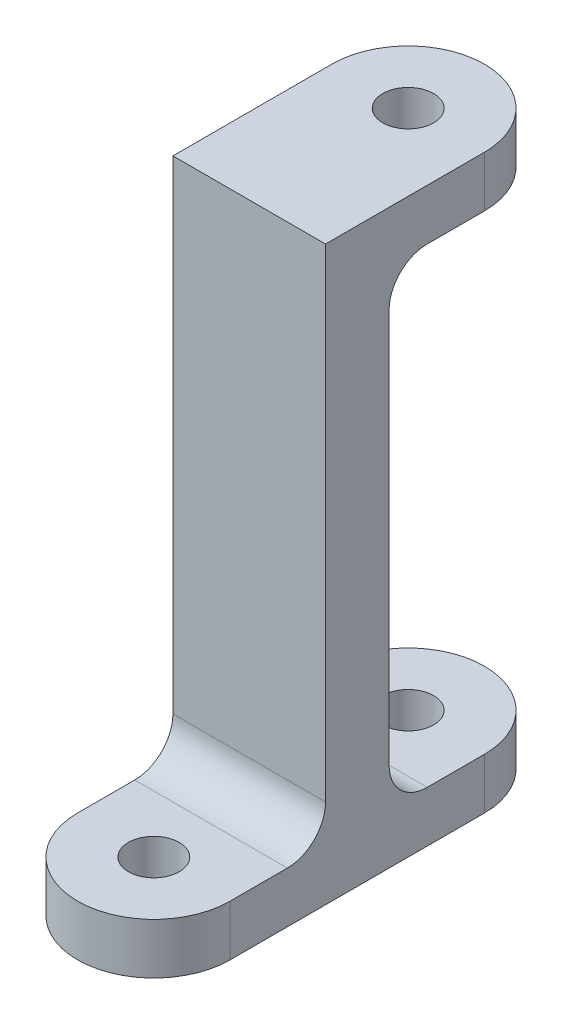
from build123d import *

# Parameters (mm, degrees)
SKETCH1_R           = 2
BOSS_EXTRUDE1_DEPTH = 4
SKETCH2_W           = 12
SKETCH2_H           = 5
BOSS_EXTRUDE2_DEPTH = 37
SKETCH3_R           = 2
SKETCH3_W           = 12
SKETCH3_H           = 5
BOSS_EXTRUDE3_DEPTH = 4
FILLET1_R           = 3


with BuildPart() as part:
    # Sketch1 → Boss-Extrude1 (new body)
    with BuildSketch(Plane(origin=(0, 0, 0), x_dir=(1, 0, 0), z_dir=(0, 1, 0))):
        with BuildLine():
            ThreePointArc((6, 20), (0, 26), (-6, 20))
            Line((-6, 20), (-6, 0))
            ThreePointArc((-6, 0), (0, -6), (6, 0))
            Line((6, 0), (6, 20))
        make_face()
        with Locations(Location((0, 20, 0), (0, 0, 270))):
            Circle(SKETCH1_R, mode=Mode.SUBTRACT)
        with Locations(Location((0, 0, 0), (0, 0, 270))):
            Circle(SKETCH1_R, mode=Mode.SUBTRACT)
    extrude(amount=BOSS_EXTRUDE1_DEPTH)

    # Sketch2 → Boss-Extrude2 (add)
    with BuildSketch(Plane(origin=(0, 4, 0), x_dir=(1, 0, 0), z_dir=(0, 1, 0))):
        with Locations((0, 10)):
            Rectangle(SKETCH2_W, SKETCH2_H)
    extrude(amount=BOSS_EXTRUDE2_DEPTH)

    # Sketch3 → Boss-Extrude3 (add)
    # profile 1 of 2: a face of its own
    with BuildSketch(Plane(origin=(0, 41, 0), x_dir=(1, 0, 0), z_dir=(0, 1, 0))):
        with BuildLine():
            Line((6, 12.5), (6, 20))
            ThreePointArc((6, 20), (0, 26), (-6, 20))
            Line((-6, 20), (-6, 12.5))
            Line((-6, 12.5), (6, 12.5))
        make_face()
        with Locations(Location((0, 20, 0), (0, 0, 270))):
            Circle(SKETCH3_R, mode=Mode.SUBTRACT)
    # profile 2 of 2: a face of its own
    with BuildSketch(Plane(origin=(0, 41, 0), x_dir=(1, 0, 0), z_dir=(0, 1, 0))):
        with Locations((0, 10)):
            Rectangle(SKETCH3_W, SKETCH3_H)
    extrude(amount=BOSS_EXTRUDE3_DEPTH)

    # Fillet1
    fillet1_edges = [part.edges().sort_by_distance(p)[0] for p in [
        (0, 4, -12.5),
        (0, 41, -12.5),
        (0, 4, -7.5),
    ]]
    fillet(fillet1_edges, radius=FILLET1_R)


solid = part.part
